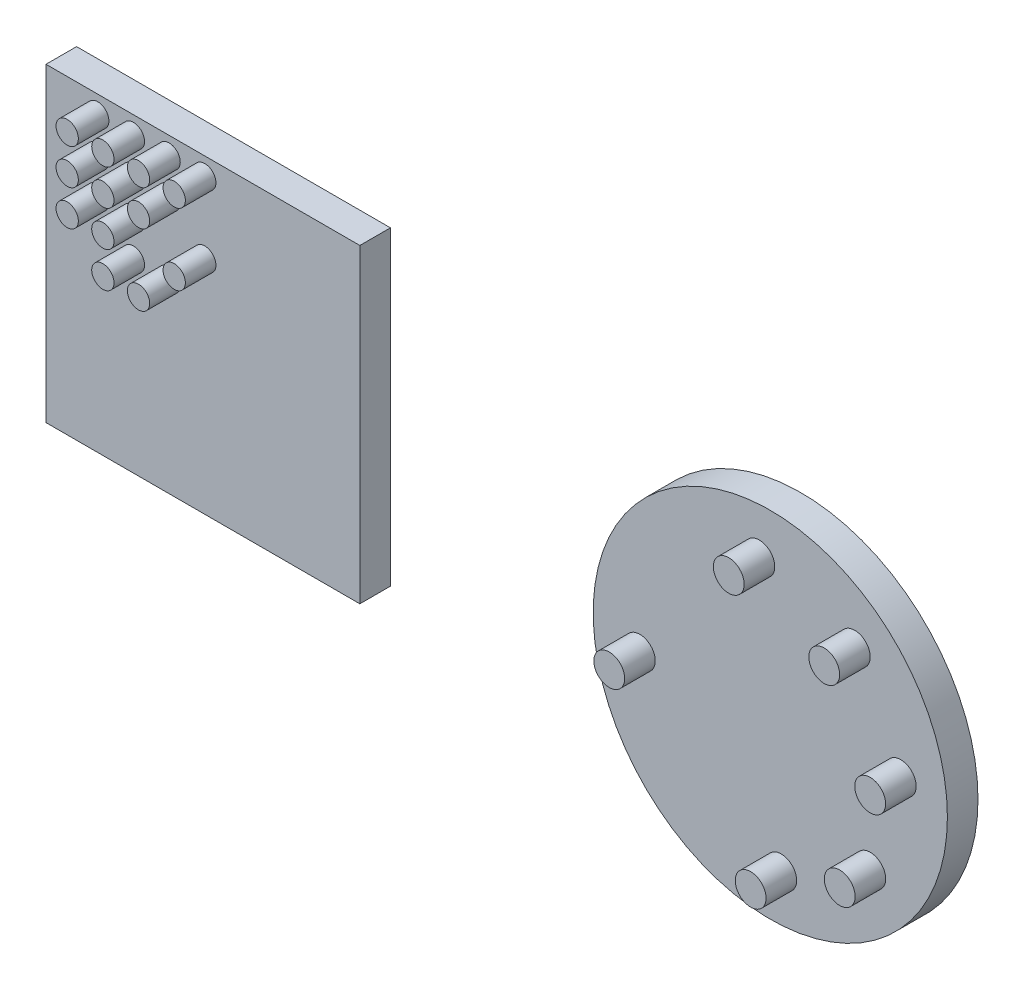
from build123d import *

# Parameters (mm, degrees)
SKETCH_1_R                  = 21.871507145
EXTRUDE_1_DEPTH             = 60
SKETCH_2_W                  = 615.786145386
SKETCH_2_H                  = 608.957645948
EXTRUDE_2_DEPTH             = 60
PATTERN_LINEAR_1_COUNT      = 4
PATTERN_LINEAR_1_PITCH      = 70
PATTERN_LINEAR_1_COUNT_DIR2 = 4
PATTERN_LINEAR_1_PITCH_DIR2 = 70
SKETCH_3_R                  = 347.526096985
EXTRUDE_3_DEPTH             = 60
SKETCH_4_R                  = 30.241800189
EXTRUDE_4_DEPTH             = 60
PATTERN_CIRCULAR_1_COUNT    = 8


with BuildPart() as part:
    # 스케치1 → 보스-돌출1 (new body)
    with BuildSketch(Plane.XY):
        with Locations((-7.009675974, -12.882647736)):
            Circle(SKETCH_1_R)
    extrude_1 = extrude(amount=EXTRUDE_1_DEPTH)

    # 스케치2 → 보스-돌출2 (add)
    with BuildSketch(Plane(origin=(0, 0, 0), x_dir=(-1, 0, 0), z_dir=(0, 0, -1))):
        with Locations((-199.319491443, -282.570126777)):
            Rectangle(SKETCH_2_W, SKETCH_2_H)
    extrude(amount=EXTRUDE_2_DEPTH)

    # 선형 패턴1: Extrude 1 4 × 4, 4 skipped
    with Locations(*[(i * PATTERN_LINEAR_1_PITCH, -j * PATTERN_LINEAR_1_PITCH_DIR2, 0) for i in range(PATTERN_LINEAR_1_COUNT) for j in range(PATTERN_LINEAR_1_COUNT_DIR2) if (i, j) not in ((0, 0), (0, 3), (2, 2), (3, 1), (3, 3))]):
        add(extrude_1)


with BuildPart() as body_2:
    # 스케치3 → 보스-돌출3 (new body)
    with BuildSketch(Plane.XY):
        with Locations((1372.540328565, -312.890998646)):
            Circle(SKETCH_3_R)
    extrude(amount=EXTRUDE_3_DEPTH)

    # 스케치4 → 보스-돌출4 (add)
    with BuildSketch(Plane.XY.offset(60)):
        with Locations((1538.343488855, -116.699191153)):
            Circle(SKETCH_4_R)
    extrude_4 = extrude(amount=EXTRUDE_4_DEPTH)

    # 원형 패턴1: 보스-돌출4 ×8 about axis, 2 skipped
    pattern_circular_1_axis = Axis((1372.540328565, -312.890998646, 0), (0, 0, 1))
    add([extrude_4.rotate(pattern_circular_1_axis, i * 360 / PATTERN_CIRCULAR_1_COUNT) for i in range(1, PATTERN_CIRCULAR_1_COUNT) if i not in (2, 4)])


solid = Compound([part.part, body_2.part])
